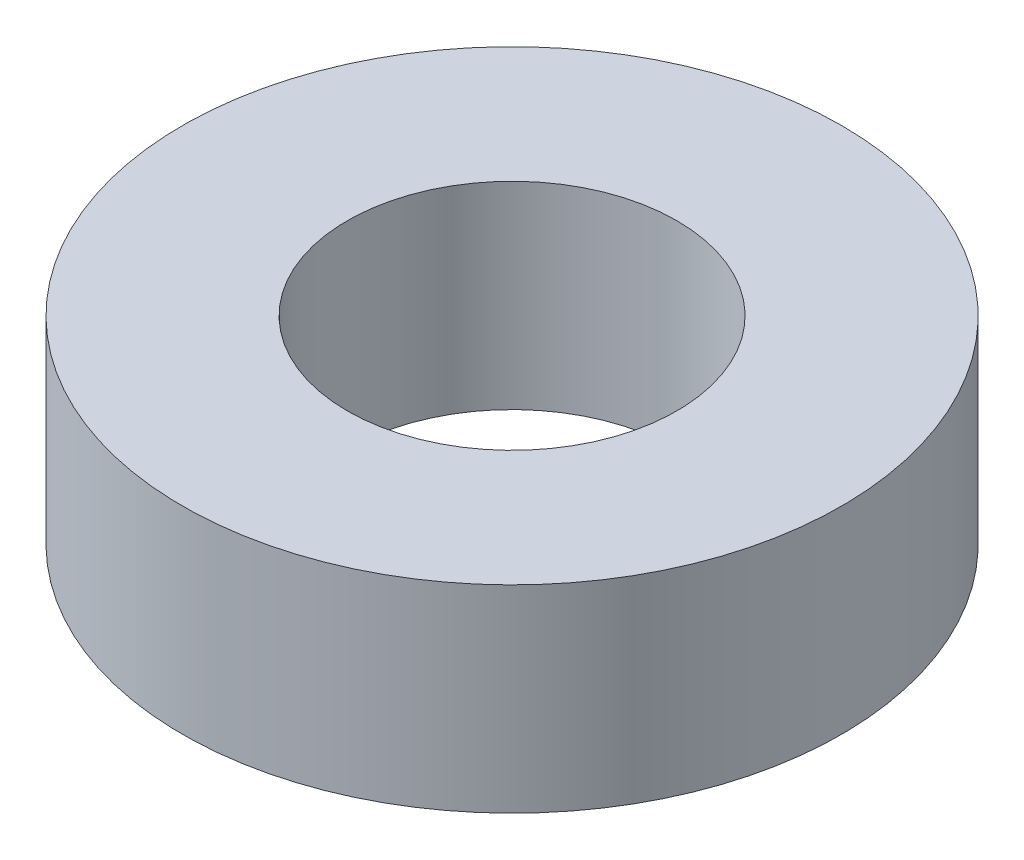
from build123d import *

# Parameters (mm, degrees)
SKETCH_1_R      = 5
SKETCH_1_R_2    = 2.5
EXTRUDE_1_DEPTH = 1.5


with BuildPart() as part:
    # 草图1 → 凸台-拉伸1 (new, symmetric)
    with BuildSketch(Plane(origin=(0, 0, 0), x_dir=(1, 0, 0), z_dir=(0, 1, 0))):
        with Locations(Location((0, 0, 0), (0, 0, 270))):
            Circle(SKETCH_1_R)
        with Locations(Location((0, 0, 0), (0, 0, 270))):
            Circle(SKETCH_1_R_2, mode=Mode.SUBTRACT)
    extrude(amount=EXTRUDE_1_DEPTH, both=True)


solid = part.part
